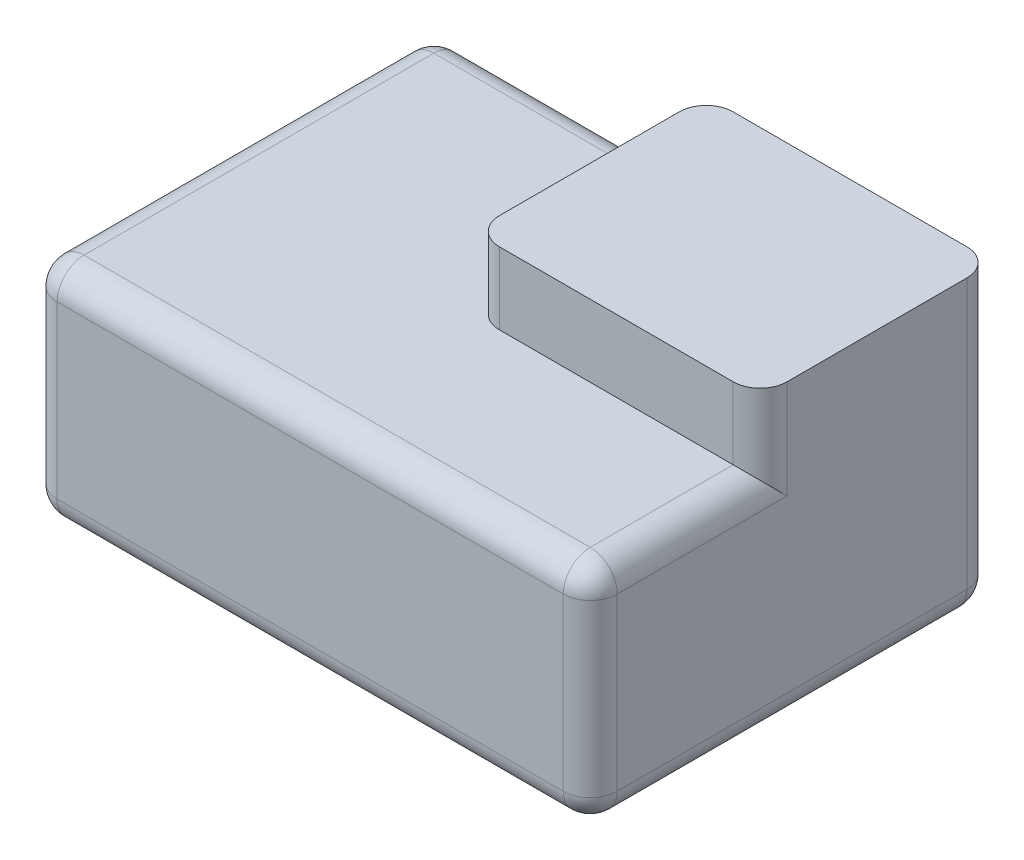
from build123d import *

# Parameters (mm, degrees)
SKETCH_1_W          = 62.3
SKETCH_1_H          = 44.9
EXTRUDE_1_DEPTH     = 33
CUT_EXTRUDE_1_DEPTH = 8
FILLET_1_R          = 3


with BuildPart() as part:
    # Эскиз1 → Бобышка-Вытянуть1 (new body)
    with BuildSketch(Plane(origin=(0, 0, 0), x_dir=(1, 0, 0), z_dir=(0, 1, 0))):
        with Locations((31.15, 22.45)):
            Rectangle(SKETCH_1_W, SKETCH_1_H)
    extrude(amount=EXTRUDE_1_DEPTH)

    # Эскиз3 → Вырез-Вытянуть1 (cut)
    with BuildSketch(Plane(origin=(0, 33, 0), x_dir=(1, 0, 0), z_dir=(0, 1, 0))):
        Polygon((30.3, 18.9), (30.3, 44.9), (0, 44.9), (0, 0), (62.3, 0), (62.3, 18.9), align=None)
    extrude(amount=-CUT_EXTRUDE_1_DEPTH, mode=Mode.SUBTRACT)

    # Скругление1
    fillet_1_edges = [part.edges().sort_by_distance(p)[0] for p in [
        (0, 12.5, -44.9),
        (62.3, 12.5, 0),
        (0, 12.5, 0),
        (30.3, 29, -44.9),
        (30.3, 29, -18.9),
        (62.3, 25, -9.45),
        (62.3, 29, -18.9),
        (31.15, 25, 0),
        (0, 25, -22.45),
        (15.15, 25, -44.9),
        (31.15, 0, -44.9),
        (62.3, 0, -22.45),
        (31.15, 0, 0),
        (0, 0, -22.45),
        (62.3, 16.5, -44.9),
    ]]
    fillet(fillet_1_edges, radius=FILLET_1_R)


solid = part.part
